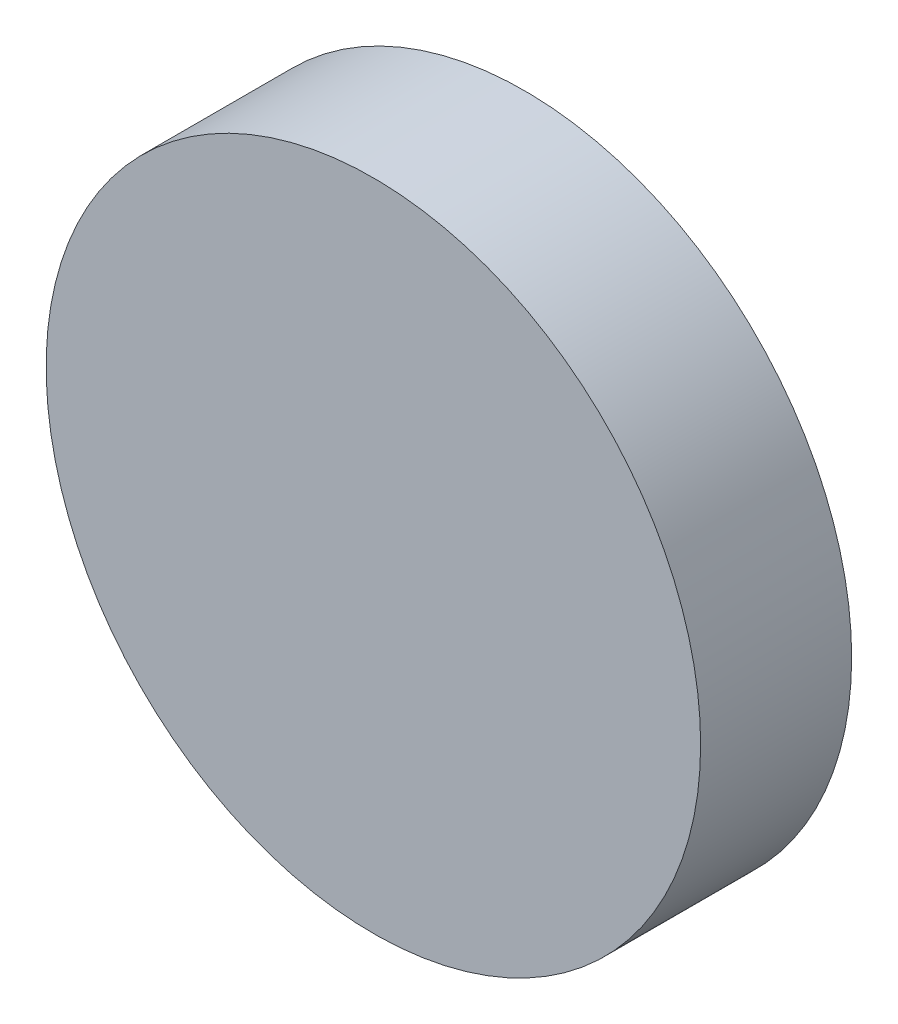
from build123d import *

# Parameters (mm, degrees)
SKETCH_1_R      = 32.5
EXTRUDE_1_DEPTH = 15


with BuildPart() as part:
    # 草图1 → 凸台-拉伸1 (new body)
    with BuildSketch(Plane.XY):
        Circle(SKETCH_1_R)
    extrude(amount=EXTRUDE_1_DEPTH)


solid = part.part
